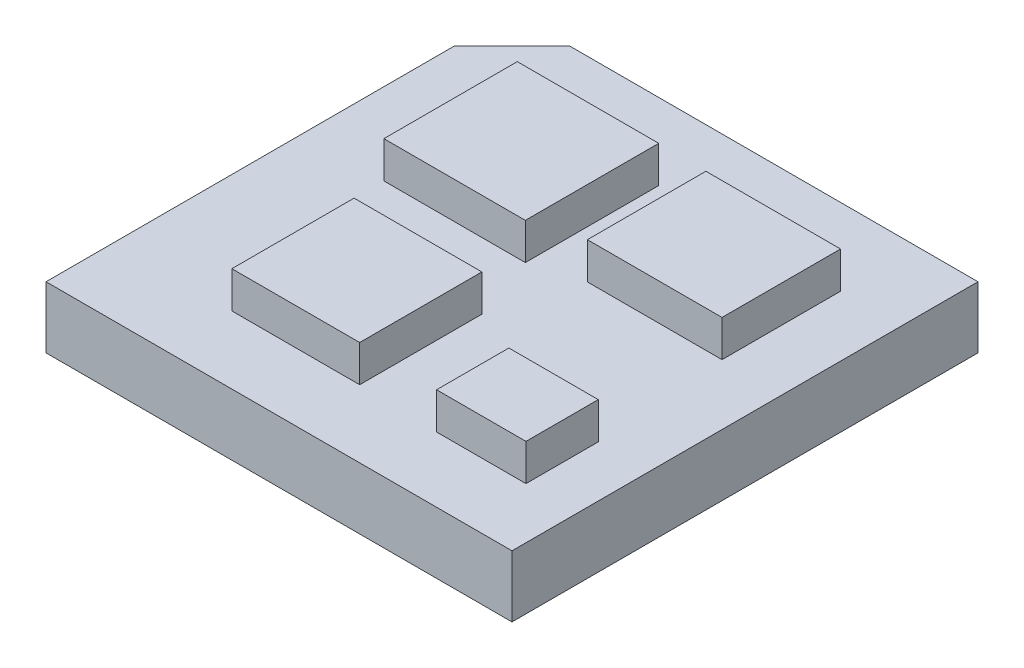
from build123d import *

# Parameters (mm, degrees)
EXTRUDE_1_DEPTH = 1.6
SKETCH_2_W      = 3.67331973
SKETCH_2_H      = 3.463876061
SKETCH_2_W_2    = 3.496098164
SKETCH_2_H_2    = 3.077210826
SKETCH_2_W_3    = 3.318876597
SKETCH_2_H_3    = 3.173877135
SKETCH_2_W_4    = 2.321089706
SKETCH_2_H_4    = 1.877636292
EXTRUDE_2_DEPTH = 0.95


with BuildPart() as part:
    # 스케치1 → 보스-돌출1 (new body)
    with BuildSketch(Plane(origin=(0, 0, 0), x_dir=(1, 0, 0), z_dir=(0, 1, 0))):
        Polygon((0, 10.6), (1.5, 12.1), (12.1, 12.1), (12.1, 0), (0, 0), align=None)
    extrude(amount=EXTRUDE_1_DEPTH)

    # 스케치2 → 보스-돌출2 (add)
    with BuildSketch(Plane(origin=(0, 1.6, 0), x_dir=(1, 0, 0), z_dir=(0, 1, 0))):
        with Locations((3.955563312, 8.386102459)):
            Rectangle(SKETCH_2_W, SKETCH_2_H)
        with Locations((8.78082322, 8.563324025)):
            Rectangle(SKETCH_2_W_2, SKETCH_2_H_2)
        with Locations((4.728893782, 3.343343358)):
            Rectangle(SKETCH_2_W_3, SKETCH_2_H_3)
        with Locations((9.60999322, 2.63077873)):
            Rectangle(SKETCH_2_W_4, SKETCH_2_H_4)
    extrude(amount=EXTRUDE_2_DEPTH)


solid = part.part
